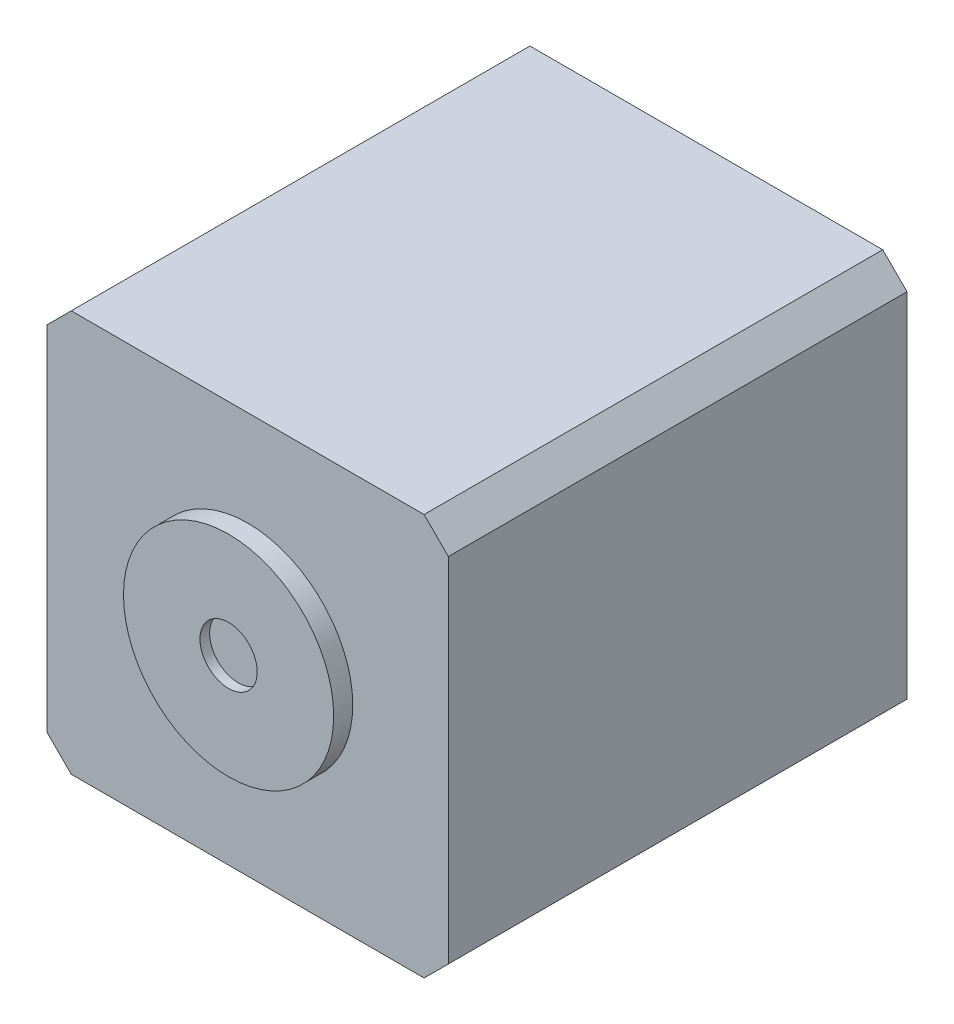
from build123d import *

# Parameters (mm, degrees)
SKETCH1_W           = 42.0116
SKETCH1_H           = 42.0116
BOSS_EXTRUDE1_DEPTH = 48.006
CHAMFER1_SIZE       = 2.54
SKETCH2_R           = 10.9982
BOSS_EXTRUDE2_DEPTH = 1.99898
SKETCH3_R           = 2.9972
CUT_EXTRUDE1_DEPTH  = 1.016


with BuildPart() as part:
    # Sketch1 → Boss-Extrude1 (new body)
    with BuildSketch(Plane.XY):
        Rectangle(SKETCH1_W, SKETCH1_H)
    extrude(amount=BOSS_EXTRUDE1_DEPTH)

    # Chamfer1
    chamfer1_edges = [part.edges().sort_by_distance(p)[0] for p in [
        (-21.0058, 21.0058, 24.003),
        (21.0058, 21.0058, 24.003),
        (21.0058, -21.0058, 24.003),
        (-21.0058, -21.0058, 24.003),
    ]]
    chamfer(chamfer1_edges, length=CHAMFER1_SIZE)

    # Sketch2 → Boss-Extrude2 (add)
    with BuildSketch(Plane.XY.offset(48.006)):
        Circle(SKETCH2_R)
    extrude(amount=BOSS_EXTRUDE2_DEPTH)

    # Sketch3 → Cut-Extrude1 (cut)
    with BuildSketch(Plane.XY.offset(50.00498)):
        Circle(SKETCH3_R)
    extrude(amount=-CUT_EXTRUDE1_DEPTH, mode=Mode.SUBTRACT)


solid = part.part
